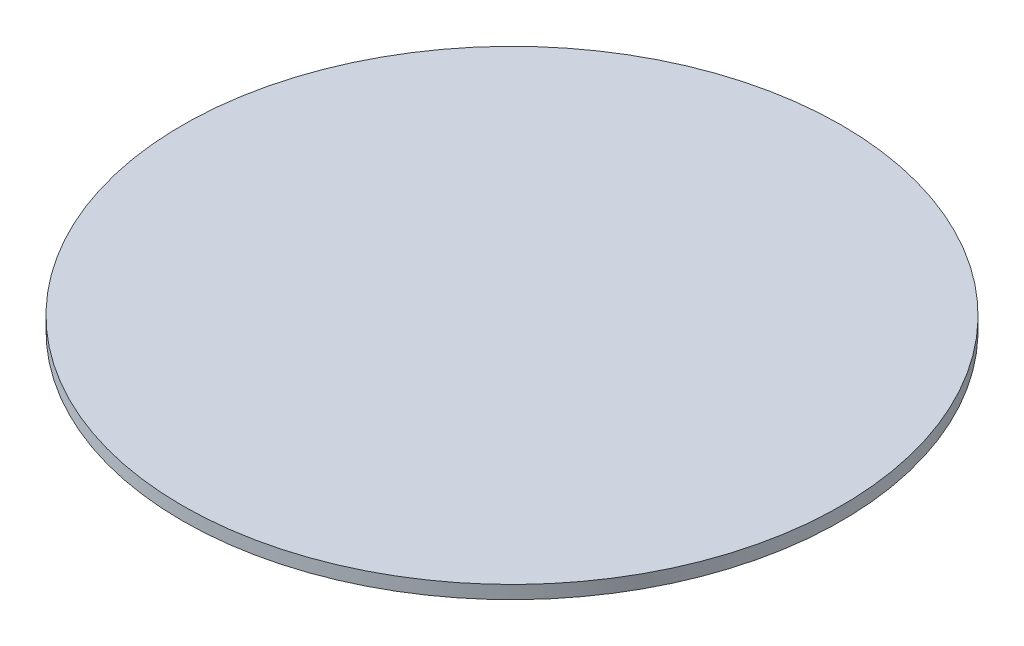
from build123d import *

# Parameters (mm, degrees)
SKETCH_1_R      = 75
EXTRUDE_1_DEPTH = 3


with BuildPart() as part:
    # 草图1 → 凸台-拉伸1 (new body)
    with BuildSketch(Plane(origin=(0, 0, 0), x_dir=(1, 0, 0), z_dir=(0, 1, 0))):
        with Locations(Location((0, 0, 0), (0, 0, 270))):
            Circle(SKETCH_1_R)
    extrude(amount=EXTRUDE_1_DEPTH)


solid = part.part
